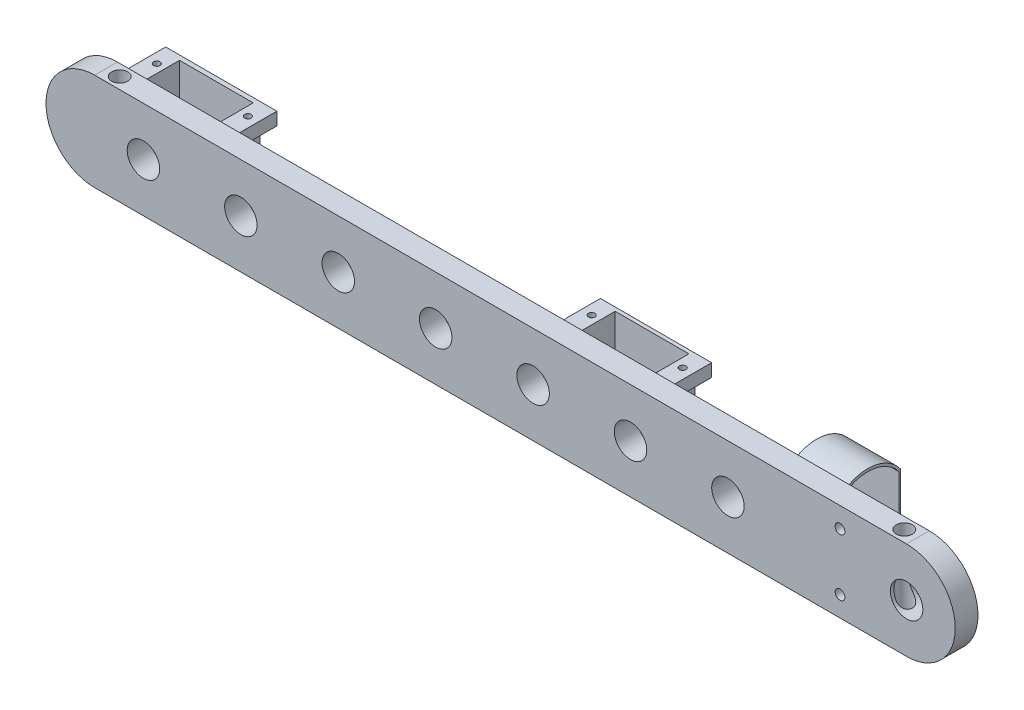
from build123d import *

# Parameters (mm, degrees)
BOSS_EXTRUDE1_DEPTH     = 7
SKETCH2_R               = 5
CUT_EXTRUDE1_DEPTH      = 7
LPATTERN1_COUNT         = 7
LPATTERN1_PITCH         = 30
SKETCH6_R               = 5
CUT_EXTRUDE2_DEPTH      = 10
BOSS_EXTRUDE2_DEPTH     = 21
CUT_EXTRUDE3_DEPTH      = 21
CUT_EXTRUDE4_REACH      = 220.014
SKETCH9_R               = 1.5
CUT_EXTRUDE5_REACH      = 220.771
SKETCH10_W              = 5.271518542
SKETCH10_H              = 23.219312301
BOSS_EXTRUDE3_DEPTH     = 14
CUT_EXTRUDE6_DEPTH      = 1
CUT_EXTRUDE6_DEPTH_BACK = 22
SKETCH12_W              = 22.7
SKETCH12_H              = 12.3
CUT_EXTRUDE7_DEPTH      = 7
CUT_EXTRUDE7_DEPTH_BACK = 7
SKETCH13_R              = 1
CUT_EXTRUDE8_REACH      = 184.393
SKETCH14_W              = 12
SKETCH14_H              = 10
CUT_EXTRUDE9_REACH      = 220.014
SKETCH15_R              = 2.5


with BuildPart() as part:
    # Sketch1 → Boss-Extrude1 (new body)
    with BuildSketch(Plane.XY):
        with BuildLine():
            Line((-200, 0), (50, 0))
            ThreePointArc((50, 0), (65, -15), (50, -30))
            Line((50, -30), (-200, -30))
            ThreePointArc((-200, -30), (-215, -15), (-200, 0))
        make_face()
    extrude(amount=BOSS_EXTRUDE1_DEPTH)

    # Sketch2 → Cut-Extrude1 (cut)
    with BuildSketch(Plane.XY.offset(7)):
        with Locations((-185, -15)):
            Circle(SKETCH2_R)
    cut_extrude1 = extrude(amount=-CUT_EXTRUDE1_DEPTH, mode=Mode.SUBTRACT)

    # LPattern1: Cut-Extrude1 ×7
    with Locations(*[(i * LPATTERN1_PITCH, 0, 0) for i in range(1, LPATTERN1_COUNT)]):
        add(cut_extrude1, mode=Mode.SUBTRACT)

    # Sketch6 → Cut-Extrude2 (cut)
    with BuildSketch(Plane(origin=(0, 0, 0), x_dir=(-1, 0, 0), z_dir=(0, 0, -1))):
        with Locations((-50, -15)):
            Circle(SKETCH6_R)
    extrude(amount=-CUT_EXTRUDE2_DEPTH, mode=Mode.SUBTRACT)

    # Sketch7 → Boss-Extrude2 (add)
    with BuildSketch(Plane(origin=(0, 0, 0), x_dir=(0, 0, -1), z_dir=(1, 0, 0))):
        with BuildLine():
            Line((20.124409349, -8.046570755), (20.124409349, -21.391782887))
            ThreePointArc((20.124409349, -21.391782887), (10.062204675, -26.149434806), (0, -21.391782887))
            Line((0, -21.391782887), (0, -8.046570755))
            ThreePointArc((0, -8.046570755), (10.062204675, -2.930122505), (20.124409349, -8.046570755))
        make_face()
    extrude(amount=BOSS_EXTRUDE2_DEPTH)

    # Sketch8 → Cut-Extrude3 (cut)
    with BuildSketch(Plane(origin=(21, 0, 0), x_dir=(0, 0, -1), z_dir=(1, 0, 0))):
        with BuildLine():
            Line((0.343653188, -8.603738845), (0.343653188, -21.003738845))
            Line((0.343653188, -21.003738845), (3.251608919, -23.33010343))
            Line((3.251608919, -23.33010343), (6.11482687, -24.672236845))
            Line((6.11482687, -24.672236845), (10.141227113, -25.388041332))
            Line((10.141227113, -25.388041332), (14.122889575, -24.672236845))
            Line((14.122889575, -24.672236845), (17.165058648, -23.33010343))
            Line((17.165058648, -23.33010343), (19.670374355, -20.953281344))
            Line((19.670374355, -20.953281344), (19.670374355, -8.553281344))
            ThreePointArc((19.670374355, -8.553281344), (9.994377841, -3.738573545), (0.343653188, -8.603738845))
        make_face()
    extrude(amount=-CUT_EXTRUDE3_DEPTH, mode=Mode.SUBTRACT)

    # Sketch9 → Cut-Extrude4 (cut, up to next)
    with BuildSketch(Plane(origin=(0, 0, 0), x_dir=(-1, 0, 0), z_dir=(0, 0, -1)), mode=Mode.PRIVATE) as cut_extrude4_sk1:
        with Locations((-29.5, -6.25)):
            Circle(SKETCH9_R)
    cut_extrude4_tool1 = extrude(cut_extrude4_sk1.sketch, amount=-CUT_EXTRUDE4_REACH, mode=Mode.PRIVATE) & part.part
    # Sketch9 → Cut-Extrude4 (cut, up to next)
    with BuildSketch(Plane(origin=(0, 0, 0), x_dir=(-1, 0, 0), z_dir=(0, 0, -1)), mode=Mode.PRIVATE) as cut_extrude4_sk2:
        with Locations((-29.5, -23.75)):
            Circle(SKETCH9_R)
    cut_extrude4_tool2 = extrude(cut_extrude4_sk2.sketch, amount=-CUT_EXTRUDE4_REACH, mode=Mode.PRIVATE) & part.part
    add(cut_extrude4_tool1.solids().sort_by_distance((29.5, -6.25, 0))[0], mode=Mode.SUBTRACT)
    add(cut_extrude4_tool2.solids().sort_by_distance((29.5, -23.75, 0))[0], mode=Mode.SUBTRACT)

    # Cut-Extrude5: up to this face of the body (flat: up to its plane)
    cut_extrude5_end = Plane(part.part.faces().sort_by_distance((-78.33059512, -15.01080435, 0))[0])
    # Sketch10 → Cut-Extrude5 (cut, up to the picked face)
    with BuildSketch(Plane(origin=(0, 0, -20.124409349), x_dir=(-1, 0, 0), z_dir=(0, 0, -1)), mode=Mode.PRIVATE) as cut_extrude5_sk1:
        with Locations((-2.635759271, -14.539778656)):
            Rectangle(SKETCH10_W, SKETCH10_H)
    cut_extrude5_tool1 = split(extrude(cut_extrude5_sk1.sketch, amount=-CUT_EXTRUDE5_REACH, mode=Mode.PRIVATE), bisect_by=cut_extrude5_end, keep=Keep.BOTH, mode=Mode.PRIVATE)
    add(cut_extrude5_tool1.solids().sort_by(Axis((2.635759, -14.539779, -20.124409), (0, 0, 1)))[0], mode=Mode.SUBTRACT)

    # Sketch11 → Boss-Extrude3 (add)
    with BuildSketch(Plane(origin=(0, 0, 0), x_dir=(-1, 0, 0), z_dir=(0, 0, -1))):
        Polygon((60.097644306, -6.420008597), (60.097644306, -23.913431972), (36.21993437, -23.913431972), (36.21993437, -6.613282571), (31.020509523, -6.613282571), (31.020509523, -2.674883318), (65.276628567, -2.674883318), (65.276628567, -6.420008597), align=None)
        Polygon((193.975354243, -6.285954501), (193.975354243, -16.540829221), (170.097644306, -16.540829221), (170.097644306, -6.479228475), (164.898219459, -6.479228475), (164.898219459, -2.540829221), (199.154338504, -2.540829221), (199.154338504, -6.285954501), align=None)
    extrude(amount=BOSS_EXTRUDE3_DEPTH)

    # Sketch12 → Cut-Extrude6 (cut, two sides: drawn at the far end of the back side and taken through both)
    with BuildSketch(Plane(origin=(0, -2.674883318, 0), x_dir=(1, 0, 0), z_dir=(0, 1, 0)).offset(-CUT_EXTRUDE6_DEPTH_BACK)):
        with Locations((-48.226628567, 6.703751831)):
            Rectangle(SKETCH12_W, SKETCH12_H)
        with Locations((-182.104338504, 6.42306456)):
            Rectangle(SKETCH12_W, SKETCH12_H)
    extrude(amount=CUT_EXTRUDE6_DEPTH + CUT_EXTRUDE6_DEPTH_BACK, mode=Mode.SUBTRACT)

    # Sketch13 → Cut-Extrude7 (cut, two sides: drawn at the far end of the back side and taken through both)
    with BuildSketch(Plane(origin=(0, -2.674883318, 0), x_dir=(1, 0, 0), z_dir=(0, 1, 0)).offset(-CUT_EXTRUDE7_DEPTH_BACK)):
        with Locations(Location((-167.998219459, 8.19, 0), (0, 0, 90))):
            Circle(SKETCH13_R)
        with Locations(Location((-196.054338504, 8.19, 0), (0, 0, 90))):
            Circle(SKETCH13_R)
        with Locations(Location((-62.176628567, 8.19, 0), (0, 0, 90))):
            Circle(SKETCH13_R)
        with Locations(Location((-34.120509523, 8.19, 0), (0, 0, 90))):
            Circle(SKETCH13_R)
    extrude(amount=CUT_EXTRUDE7_DEPTH + CUT_EXTRUDE7_DEPTH_BACK, mode=Mode.SUBTRACT)

    # Cut-Extrude8: up to this face of the body (flat: up to its plane)
    cut_extrude8_end = Plane(part.part.faces().sort_by_distance((-193.975354243, -11.413391861, -7))[0])
    # Sketch14 → Cut-Extrude8 (cut, up to the picked face)
    with BuildSketch(Plane(origin=(-36.21993437, 0, 0), x_dir=(0, 0, -1), z_dir=(1, 0, 0)), mode=Mode.PRIVATE) as cut_extrude8_sk1:
        with Locations((8, -18.913431972)):
            Rectangle(SKETCH14_W, SKETCH14_H)
    cut_extrude8_tool1 = split(extrude(cut_extrude8_sk1.sketch, amount=-CUT_EXTRUDE8_REACH, mode=Mode.PRIVATE), bisect_by=cut_extrude8_end, keep=Keep.BOTH, mode=Mode.PRIVATE)
    add(cut_extrude8_tool1.solids().sort_by(Axis((-36.219934, -18.913432, -8), (-1, 0, 0)))[0], mode=Mode.SUBTRACT)

    # Sketch15 → Cut-Extrude9 (cut, up to next)
    with BuildSketch(Plane(origin=(0, 0, 0), x_dir=(1, 0, 0), z_dir=(0, 1, 0)), mode=Mode.PRIVATE) as cut_extrude9_sk1:
        with Locations(Location((-195.8, -3.5, 0), (0, 0, 180))):
            Circle(SKETCH15_R)
    cut_extrude9_tool1 = extrude(cut_extrude9_sk1.sketch, amount=-CUT_EXTRUDE9_REACH, mode=Mode.PRIVATE) & part.part
    # Sketch15 → Cut-Extrude9 (cut, up to next)
    with BuildSketch(Plane(origin=(0, 0, 0), x_dir=(1, 0, 0), z_dir=(0, 1, 0)), mode=Mode.PRIVATE) as cut_extrude9_sk2:
        with Locations(Location((45.8, -3.5, 0), (0, 0, 180))):
            Circle(SKETCH15_R)
    cut_extrude9_tool2 = extrude(cut_extrude9_sk2.sketch, amount=-CUT_EXTRUDE9_REACH, mode=Mode.PRIVATE) & part.part
    add(cut_extrude9_tool1.solids().sort_by_distance((-195.8, 0, 3.5))[0], mode=Mode.SUBTRACT)
    add(cut_extrude9_tool2.solids().sort_by_distance((45.8, 0, 3.5))[0], mode=Mode.SUBTRACT)


solid = part.part
